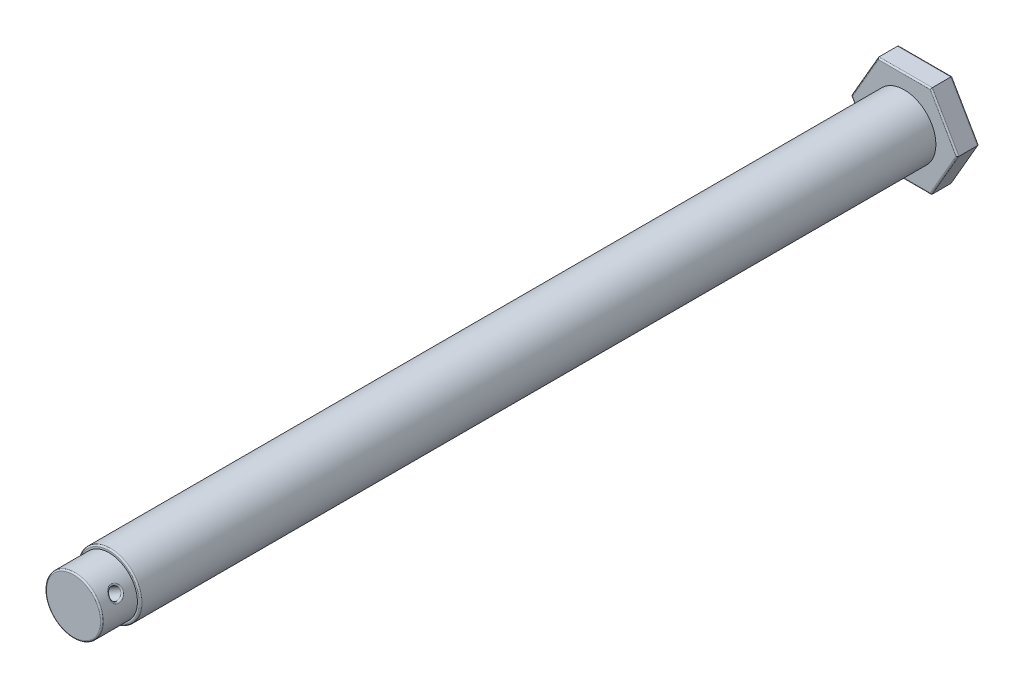
from build123d import *

# Parameters (mm, degrees)
EXTRUDE_1_DEPTH     = 15
SKETCH_2_R          = 22.25
EXTRUDE_2_DEPTH     = 560
SKETCH_3_R          = 20
EXTRUDE_3_DEPTH     = 25
SKETCH_4_R          = 4
CUT_EXTRUDE_4_DEPTH = 606.548993339
FILLET_1_R          = 1


with BuildPart() as part:
    # 草图1 → 拉伸1 (new body)
    with BuildSketch(Plane.XY):
        Polygon((37.527767497, 0), (18.763883749, 32.5), (-18.763883749, 32.5), (-37.527767497, 0), (-18.763883749, -32.5), (18.763883749, -32.5), align=None)
    extrude(amount=EXTRUDE_1_DEPTH)

    # 草图2 → 拉伸2 (add)
    with BuildSketch(Plane.XY.offset(15)):
        Circle(SKETCH_2_R)
    extrude(amount=EXTRUDE_2_DEPTH)

    # 草图3 → 拉伸3 (add)
    with BuildSketch(Plane.XY.offset(575)):
        Circle(SKETCH_3_R)
    extrude(amount=EXTRUDE_3_DEPTH)

    # 草图4 → 拉伸4 (cut, through all)
    with BuildSketch(Plane(origin=(-28.145825623, -16.25, 0), x_dir=(0, 0, 1), z_dir=(-0.8660254037844388, -0.4999999999999997, 0))):
        with Locations(Location((587.5, 0, 0), (0, 0, 270))):
            Circle(SKETCH_4_R)
    extrude(amount=-CUT_EXTRUDE_4_DEPTH, mode=Mode.SUBTRACT)

    # 圆角1
    fillet_1_edges = [part.edges().sort_by_distance(p)[0] for p in [
        (0, 32.5, 15),
        (-28.145825623, 16.25, 15),
        (-28.145825623, -16.25, 15),
        (0, -32.5, 15),
        (-22.25, 0, 575),
        (-20, 0, 600),
        (-18.970562748, -6.333857356, 587.5),
        (14.970562748, 13.262060586, 587.5),
        (28.145825623, -16.25, 15),
        (0, -32.5, 0),
        (-28.145825623, -16.25, 0),
        (-28.145825623, 16.25, 0),
        (28.145825623, 16.25, 15),
        (0, 32.5, 0),
        (28.145825623, 16.25, 0),
        (28.145825623, -16.25, 0),
    ]]
    fillet(fillet_1_edges, radius=FILLET_1_R)


solid = part.part
